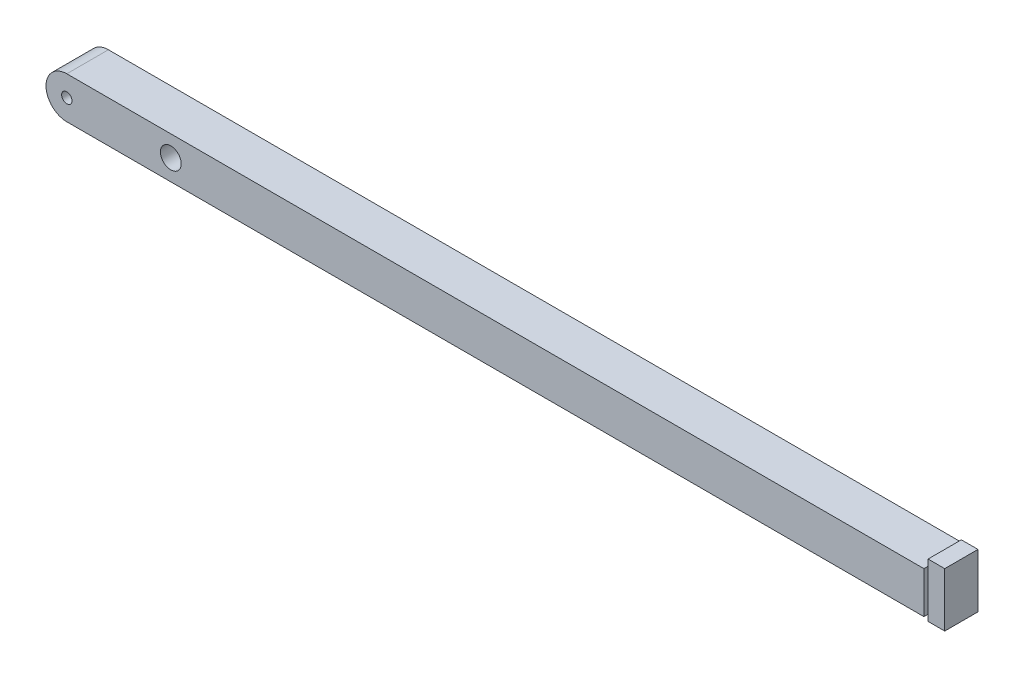
from build123d import *

# Parameters (mm, degrees)
BOSS_EXTRUDE1_DEPTH = 12.7
SKETCH1_10_R        = 3.175
SKETCH1_10_R_2      = 6.35
CUT_EXTRUDE3_DEPTH  = 12.7
SKETCH2_W           = 2.54
SKETCH2_H           = 25.4
CUT_EXTRUDE4_DEPTH  = 10.16
SKETCH2_3_W         = 20.32
SKETCH2_3_H         = 3.81
BOSS_EXTRUDE2_DEPTH = 10.16


with BuildPart() as part:
    # Sketch1 → Boss-Extrude1 (new, symmetric)
    with BuildSketch(Plane.XY):
        with BuildLine():
            Line((609.6, 0), (609.6, 25.4))
            Line((609.6, 25.4), (76.2, 25.4))
            ThreePointArc((76.2, 25.4), (63.5, 12.7), (76.2, 0))
            Line((76.2, 0), (609.6, 0))
        make_face()
    extrude(amount=BOSS_EXTRUDE1_DEPTH, both=True)

    # Sketch1<10> → Cut-Extrude3 (cut, symmetric)
    with BuildSketch(Plane.XY):
        with Locations((76.2, 12.7)):
            Circle(SKETCH1_10_R)
        with Locations((139.699994312, 12.7)):
            Circle(SKETCH1_10_R_2)
    extrude(amount=CUT_EXTRUDE3_DEPTH, both=True, mode=Mode.SUBTRACT)

    # Sketch2 → Cut-Extrude4 (cut)
    with BuildSketch(Plane(origin=(609.6, 0, 0), x_dir=(0, 0, -1), z_dir=(1, 0, 0))):
        with Locations((-11.43, 12.7)):
            Rectangle(SKETCH2_W, SKETCH2_H)
        with Locations((11.43, 12.7)):
            Rectangle(SKETCH2_W, SKETCH2_H)
    extrude(amount=-CUT_EXTRUDE4_DEPTH, mode=Mode.SUBTRACT)

    # Sketch2<3> → Boss-Extrude2 (add)
    with BuildSketch(Plane(origin=(609.6, 0, 0), x_dir=(0, 0, -1), z_dir=(1, 0, 0))):
        with Locations((0, 27.305)):
            Rectangle(SKETCH2_3_W, SKETCH2_3_H)
        with Locations((0, -1.905)):
            Rectangle(SKETCH2_3_W, SKETCH2_3_H)
    extrude(amount=-BOSS_EXTRUDE2_DEPTH)


solid = part.part
